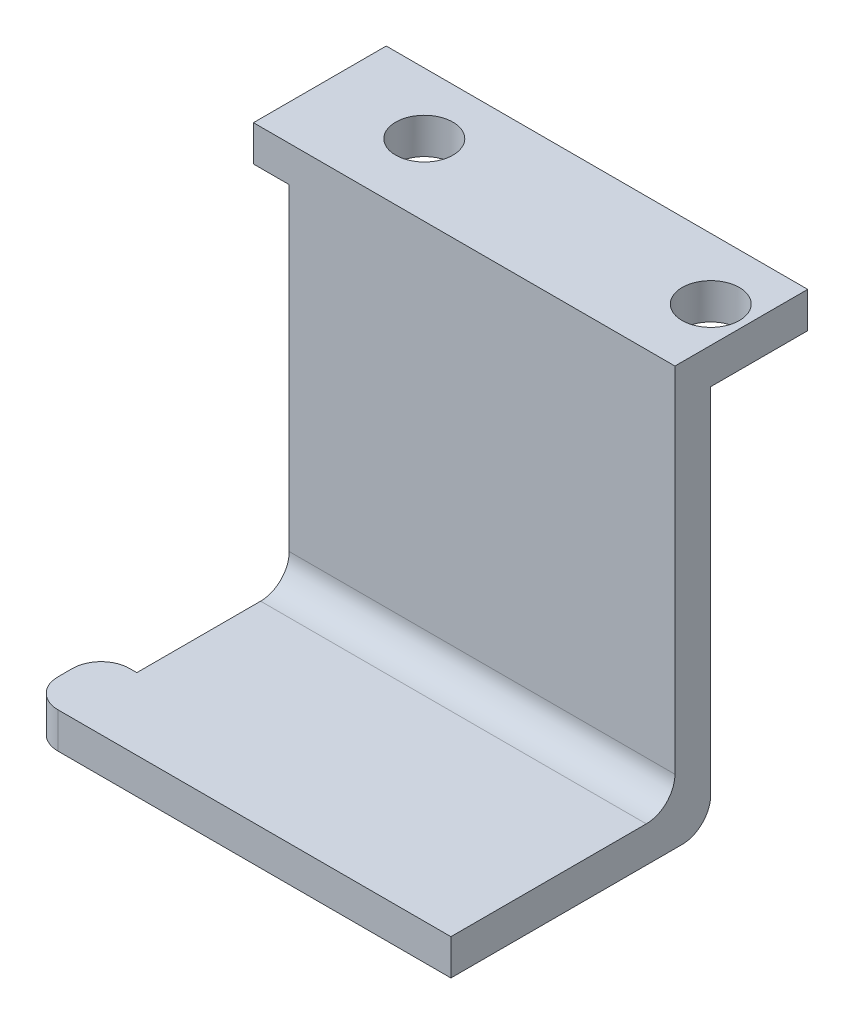
from build123d import *

# Parameters (mm, degrees)
SKETCH1_W           = 37.3761
SKETCH1_H           = 33.88868
BOSS_EXTRUDE1_DEPTH = 3.175
SKETCH2_W           = 37.3761
SKETCH2_H           = 3.175
BOSS_EXTRUDE2_DEPTH = 23.04034
BOSS_EXTRUDE3_START = -3.175
SKETCH3_W           = 37.3761
SKETCH3_H           = 3.175
BOSS_EXTRUDE3_DEPTH = 11.77544
SKETCH4_R           = 2.54
CUT_EXTRUDE1_DEPTH  = 48.474381041
SKETCH5_W           = 3.175
SKETCH5_H           = 13.51534
CUT_EXTRUDE2_DEPTH  = 46.039350709
SKETCH6_W           = 3.175
SKETCH6_H           = 33.88868
CUT_EXTRUDE3_DEPTH  = 46.884205894
FILLET1_R           = 2.54
FILLET2_R           = 2.54


with BuildPart() as part:
    # Sketch1 → Boss-Extrude1 (new body)
    with BuildSketch(Plane.XY):
        Rectangle(SKETCH1_W, SKETCH1_H)
    extrude(amount=BOSS_EXTRUDE1_DEPTH)

    # Sketch2 → Boss-Extrude2 (add)
    with BuildSketch(Plane(origin=(0, 0, 0), x_dir=(-1, 0, 0), z_dir=(0, 0, -1))):
        with Locations((0, -15.35684)):
            Rectangle(SKETCH2_W, SKETCH2_H)
    extrude(amount=-BOSS_EXTRUDE2_DEPTH)

    # Sketch3 → Boss-Extrude3 (add)
    with BuildSketch(Plane(origin=(0, 0, 0), x_dir=(-1, 0, 0), z_dir=(0, 0, -1)).offset(BOSS_EXTRUDE3_START)):
        with Locations((0, 18.53184)):
            Rectangle(SKETCH3_W, SKETCH3_H)
    extrude(amount=BOSS_EXTRUDE3_DEPTH)

    # Sketch4 → Cut-Extrude1 (cut, through all)
    with BuildSketch(Plane(origin=(0, 20.11934, 0), x_dir=(1, 0, 0), z_dir=(0, 1, 0))):
        with Locations(Location((-9.88695, 3.175, 0), (0, 0, 270))):
            Circle(SKETCH4_R)
        with Locations(Location((15.51305, 3.175, 0), (0, 0, 270))):
            Circle(SKETCH4_R)
    extrude(amount=-CUT_EXTRUDE1_DEPTH, mode=Mode.SUBTRACT)

    # Sketch5 → Cut-Extrude2 (cut, through all)
    with BuildSketch(Plane(origin=(0, -13.76934, 0), x_dir=(1, 0, 0), z_dir=(0, 1, 0))):
        with Locations((-17.10055, -9.93267)):
            Rectangle(SKETCH5_W, SKETCH5_H)
    extrude(amount=-CUT_EXTRUDE2_DEPTH, mode=Mode.SUBTRACT)

    # Sketch6 → Cut-Extrude3 (cut, through all)
    with BuildSketch(Plane.ZY.offset(15.51305)):
        with Locations((1.5875, 0)):
            Rectangle(SKETCH6_W, SKETCH6_H)
    extrude(amount=CUT_EXTRUDE3_DEPTH, mode=Mode.SUBTRACT)

    # Fillet1
    fillet1_edges = [part.edges().sort_by_distance(p)[0] for p in [
        (-18.68805, -15.35684, 23.04034),
        (1.5875, -13.76934, 3.175),
        (-18.68805, -15.35684, 16.69034),
    ]]
    fillet(fillet1_edges, radius=FILLET1_R)

    # Fillet2
    fillet2_edges = [part.edges().sort_by_distance(p)[0] for p in [
        (1.5875, -16.94434, 0),
    ]]
    fillet(fillet2_edges, radius=FILLET2_R)


solid = part.part
